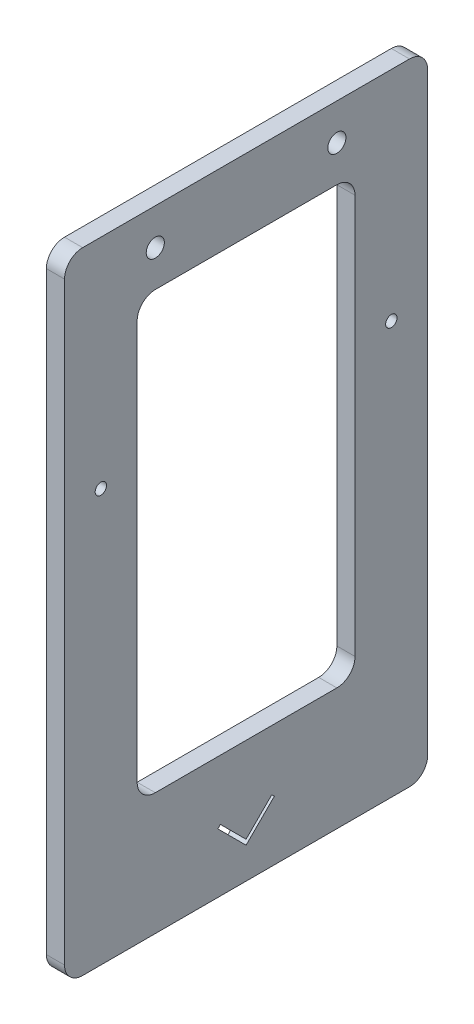
from build123d import *

# Parameters (mm, degrees)
BOSS_EXTRUDE2_DEPTH     = 6.35
CUT_EXTRUDE1_REACH      = 129.376
CUT_EXTRUDE2_DEPTH      = 128.37561853
CUT_EXTRUDE2_DEPTH_BACK = 128.37561853
SKETCH5_R               = 3.175
SKETCH6_R               = 1.984375
CUT_EXTRUDE3_DEPTH      = 128.37561853


with BuildPart() as part:
    # Sketch3 → Boss-Extrude2 (new body)
    with BuildSketch(Plane(origin=(0, 0, 0), x_dir=(0, 0, -1), z_dir=(1, 0, 0))):
        with BuildLine():
            Line((-57.15, -110.236), (57.15, -110.236))
            ThreePointArc((57.15, -110.236), (61.640128061, -108.376128061), (63.5, -103.886))
            Line((63.5, -103.886), (63.5, 103.886))
            ThreePointArc((63.5, 103.886), (61.640128061, 108.376128061), (57.15, 110.236))
            Line((57.15, 110.236), (-57.15, 110.236))
            ThreePointArc((-57.15, 110.236), (-61.640128061, 108.376128061), (-63.5, 103.886))
            Line((-63.5, 103.886), (-63.5, -103.886))
            ThreePointArc((-63.5, -103.886), (-61.640128061, -108.376128061), (-57.15, -110.236))
        make_face()
        with BuildLine():
            Line((-31.75, -67.564), (31.75, -67.564))
            ThreePointArc((31.75, -67.564), (36.240128061, -65.704128061), (38.1, -61.214))
            Line((38.1, -61.214), (38.1, 78.486))
            ThreePointArc((38.1, 78.486), (36.240128061, 82.976128061), (31.75, 84.836))
            Line((31.75, 84.836), (-31.75, 84.836))
            ThreePointArc((-31.75, 84.836), (-36.240128061, 82.976128061), (-38.1, 78.486))
            Line((-38.1, 78.486), (-38.1, -61.214))
            ThreePointArc((-38.1, -61.214), (-36.240128061, -65.704128061), (-31.75, -67.564))
        make_face(mode=Mode.SUBTRACT)
    extrude(amount=BOSS_EXTRUDE2_DEPTH)

    # Sketch4 → Cut-Extrude1 (cut, up to next)
    with BuildSketch(Plane(origin=(6.35, 0, 0), x_dir=(0, 0, -1), z_dir=(1, 0, 0)), mode=Mode.PRIVATE) as cut_extrude1_sk1:
        Polygon((0, -97.536), (-8.980256121, -88.555743879), (-9.878281733, -89.453769491), (0, -99.332051224), (9.878281733, -89.453769491), (8.980256121, -88.555743879), align=None)
    cut_extrude1_tool1 = extrude(cut_extrude1_sk1.sketch, amount=-CUT_EXTRUDE1_REACH, mode=Mode.PRIVATE) & part.part
    add(cut_extrude1_tool1.solids().sort_by_distance((6.35, -93.205002, 4.649259))[0], mode=Mode.SUBTRACT)

    # Sketch5 → Cut-Extrude2 (cut, two sides: drawn at the far end of the back side and taken through both)
    with BuildSketch(Plane(origin=(6.35, 0, 0), x_dir=(0, 0, -1), z_dir=(1, 0, 0)).offset(-CUT_EXTRUDE2_DEPTH_BACK)):
        with Locations((-31.75, 97.536)):
            Circle(SKETCH5_R)
        with Locations((31.75, 97.536)):
            Circle(SKETCH5_R)
    extrude(amount=CUT_EXTRUDE2_DEPTH + CUT_EXTRUDE2_DEPTH_BACK, mode=Mode.SUBTRACT)

    # Sketch6 → Cut-Extrude3 (cut, through all)
    with BuildSketch(Plane(origin=(6.35, 0, 0), x_dir=(0, 0, -1), z_dir=(1, 0, 0))):
        with Locations((-50.8, 34.036)):
            Circle(SKETCH6_R)
        with Locations(Location((50.8, 34.036, 0), (0, 0, 180))):
            Circle(SKETCH6_R)
    extrude(amount=-CUT_EXTRUDE3_DEPTH, mode=Mode.SUBTRACT)


solid = part.part
